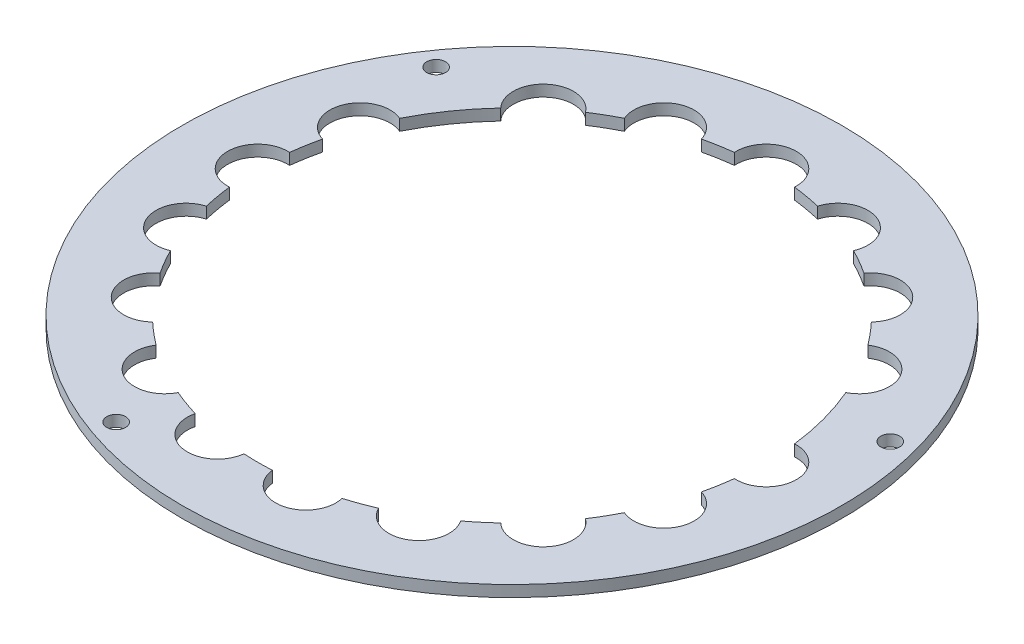
from build123d import *

# Parameters (mm, degrees)
SKETCH1_R                = 17.5
BOSS_EXTRUDE1_DEPTH      = 0.6
CUT_EXTRUDE1_REACH       = 26.756
SKETCH2_R                = 13.5
CUT_EXTRUDE2_REACH       = 26.756
SKETCH3_R                = 1.6
CIRPATTERN1_COUNT        = 6
CIRPATTERN1_ANGLE        = 100
CUT_EXTRUDE3_REACH       = 26.756
SKETCH4_R                = 1.6
CIRPATTERN2_COUNT        = 11
CIRPATTERN2_ANGLE        = 200
F_1_0_1_DIAMETER_HOLE1_D = 1


with BuildPart() as part:
    # Sketch1 → Boss-Extrude1 (new body)
    with BuildSketch(Plane(origin=(0, 0, 0), x_dir=(1, 0, 0), z_dir=(0, 1, 0))):
        with Locations(Location((0, 0, 0), (0, 0, 270))):
            Circle(SKETCH1_R)
    extrude(amount=BOSS_EXTRUDE1_DEPTH)

    # Sketch2 → Cut-Extrude1 (cut, up to next)
    with BuildSketch(Plane(origin=(0, 0.6, 0), x_dir=(1, 0, 0), z_dir=(0, 1, 0)), mode=Mode.PRIVATE) as cut_extrude1_sk1:
        with Locations(Location((0, 0, 0), (0, 0, 270))):
            Circle(SKETCH2_R)
    cut_extrude1_tool1 = extrude(cut_extrude1_sk1.sketch, amount=-CUT_EXTRUDE1_REACH, mode=Mode.PRIVATE) & part.part
    add(cut_extrude1_tool1.solids().sort_by_distance((0, 0.6, 0))[0], mode=Mode.SUBTRACT)

    # Sketch3 → Cut-Extrude2 (cut, up to next)
    with BuildSketch(Plane(origin=(0, 0.6, 0), x_dir=(1, 0, 0), z_dir=(0, 1, 0)), mode=Mode.PRIVATE) as cut_extrude2_sk1:
        with Locations((11.691342951, 6.75)):
            Circle(SKETCH3_R)
    cut_extrude2_tool1 = extrude(cut_extrude2_sk1.sketch, amount=-CUT_EXTRUDE2_REACH, mode=Mode.PRIVATE) & part.part
    cut_extrude2 = cut_extrude2_tool1.solids().sort_by_distance((11.691343, 0.6, -6.75))[0]
    add(cut_extrude2, mode=Mode.SUBTRACT)

    # CirPattern1: Cut-Extrude2 ×6 about axis
    cirpattern1_axis = Axis((0, 0, 0), (0, 1, 0))
    for i in range(1, CIRPATTERN1_COUNT):
        add(cut_extrude2.rotate(cirpattern1_axis, i * CIRPATTERN1_ANGLE / (CIRPATTERN1_COUNT - 1)), mode=Mode.SUBTRACT)

    # Sketch4 → Cut-Extrude3 (cut, up to next)
    with BuildSketch(Plane(origin=(0, 0.6, 0), x_dir=(1, 0, 0), z_dir=(0, 1, 0)), mode=Mode.PRIVATE) as cut_extrude3_sk1:
        with Locations((13.5, 0)):
            Circle(SKETCH4_R)
    cut_extrude3_tool1 = extrude(cut_extrude3_sk1.sketch, amount=-CUT_EXTRUDE3_REACH, mode=Mode.PRIVATE) & part.part
    cut_extrude3 = cut_extrude3_tool1.solids().sort_by_distance((13.5, 0.6, 0))[0]
    add(cut_extrude3, mode=Mode.SUBTRACT)

    # CirPattern2: Cut-Extrude3 ×11 about axis
    cirpattern2_axis = Axis((0, 0, 0), (0, -1, 0))
    for i in range(1, CIRPATTERN2_COUNT):
        add(cut_extrude3.rotate(cirpattern2_axis, i * CIRPATTERN2_ANGLE / (CIRPATTERN2_COUNT - 1)), mode=Mode.SUBTRACT)

    # Ø1.0 (1) Diameter Hole1 (through all)
    with Locations(Plane(origin=(0, 0.6, 0), x_dir=(1, 0, 0), z_dir=(0, 1, 0))):
        with Locations((15.841183551, 4.24463234), (-13.434093526, 9.406653556), (-5.609130351, -15.410958981)):
            Hole(F_1_0_1_DIAMETER_HOLE1_D / 2)


solid = part.part
